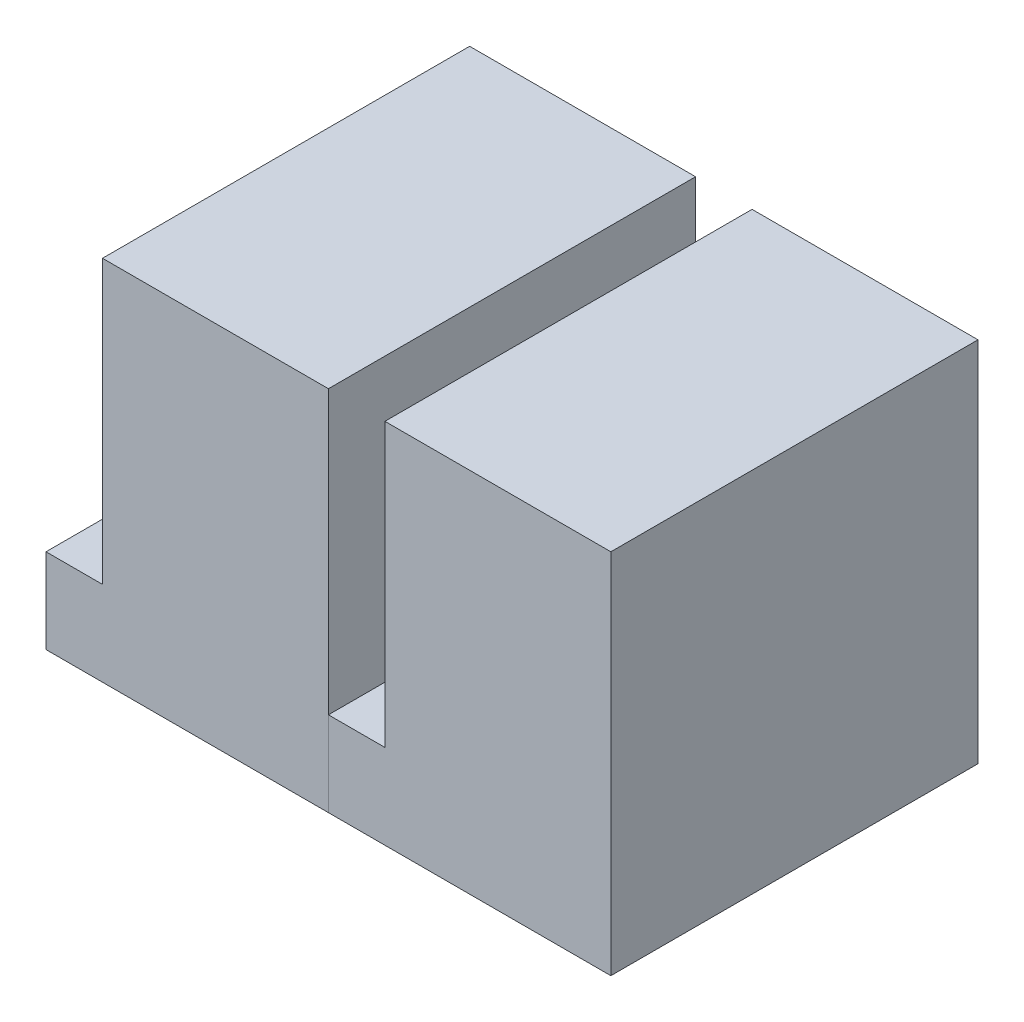
from build123d import *

# Parameters (mm, degrees)
SKETCH1_W           = 8
SKETCH1_H           = 13
BOSS_EXTRUDE1_DEPTH = 13
SKETCH2_W           = 6
SKETCH2_H           = 11
CUT_EXTRUDE1_DEPTH  = 12
SKETCH3_W           = 13
SKETCH3_H           = 3
BOSS_EXTRUDE2_DEPTH = 2
LPATTERN1_COUNT     = 2
LPATTERN1_PITCH     = 10


with BuildPart() as part:
    # Sketch1 → Boss-Extrude1 (new body)
    with BuildSketch(Plane(origin=(0, 0, 0), x_dir=(1, 0, 0), z_dir=(0, 1, 0))):
        with Locations((4, 6.5)):
            Rectangle(SKETCH1_W, SKETCH1_H)
    extrude(amount=BOSS_EXTRUDE1_DEPTH)

    # Sketch2 → Cut-Extrude1 (cut)
    with BuildSketch(Plane.XZ):
        with Locations((4, -6.5)):
            Rectangle(SKETCH2_W, SKETCH2_H)
    extrude(amount=-CUT_EXTRUDE1_DEPTH, mode=Mode.SUBTRACT)

    # Sketch3 → Boss-Extrude2 (add)
    with BuildSketch(Plane.ZY):
        with Locations((-6.5, 1.5)):
            Rectangle(SKETCH3_W, SKETCH3_H)
    extrude(amount=BOSS_EXTRUDE2_DEPTH)


with BuildPart() as lpattern1_1:
    # LPattern1: pattern copy
    add(part.part.moved(Location(Vector(-1, 0, 0) * (1 * LPATTERN1_PITCH))))


solid = Compound([part.part, lpattern1_1.part])
